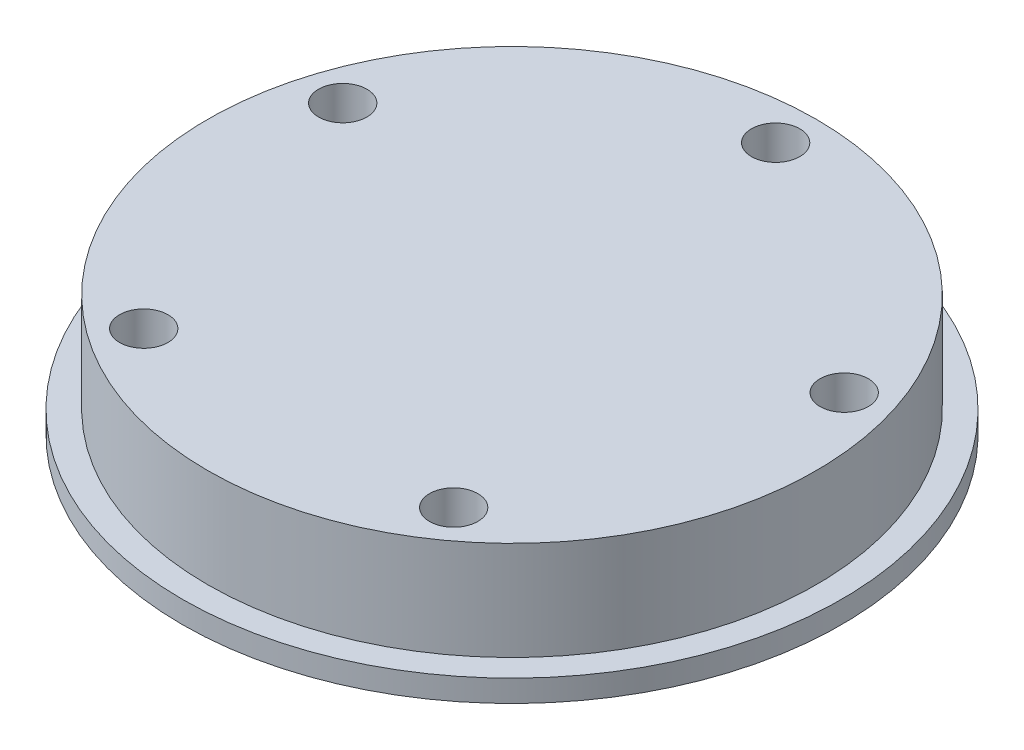
from build123d import *

# Parameters (mm, degrees)
SKETCH3_R           = 27.7
BOSS_EXTRUDE2_DEPTH = 11
SKETCH4_R           = 30
BOSS_EXTRUDE3_DEPTH = 2
SKETCH5_R           = 2.2
CUT_EXTRUDE1_DEPTH  = 44.829214002


with BuildPart() as part:
    # Sketch3 → Boss-Extrude2 (new body)
    with BuildSketch(Plane(origin=(0, 0, 0), x_dir=(1, 0, 0), z_dir=(0, 1, 0))):
        with Locations(Location((0, 0, 0), (0, 0, 270))):
            Circle(SKETCH3_R)
    extrude(amount=BOSS_EXTRUDE2_DEPTH)

    # Sketch4 → Boss-Extrude3 (add)
    with BuildSketch(Plane(origin=(0, 0, 0), x_dir=(1, 0, 0), z_dir=(0, 1, 0))):
        with Locations(Location((0, 0, 0), (0, 0, 270))):
            Circle(SKETCH4_R)
    extrude(amount=BOSS_EXTRUDE3_DEPTH)

    # Sketch5 → Cut-Extrude1 (cut, through all)
    with BuildSketch(Plane(origin=(0, 11, 0), x_dir=(1, 0, 0), z_dir=(0, 1, 0))):
        with Locations(Location((0, 24, 0), (0, 0, 270))):
            Circle(SKETCH5_R)
        with Locations(Location((22.825356391, 7.416407865, 0), (0, 0, 270))):
            Circle(SKETCH5_R)
        with Locations(Location((14.106846055, -19.416407865, 0), (0, 0, 270))):
            Circle(SKETCH5_R)
        with Locations(Location((-14.106846055, -19.416407865, 0), (0, 0, 270))):
            Circle(SKETCH5_R)
        with Locations(Location((-22.825356391, 7.416407865, 0), (0, 0, 270))):
            Circle(SKETCH5_R)
    extrude(amount=-CUT_EXTRUDE1_DEPTH, mode=Mode.SUBTRACT)


solid = part.part
